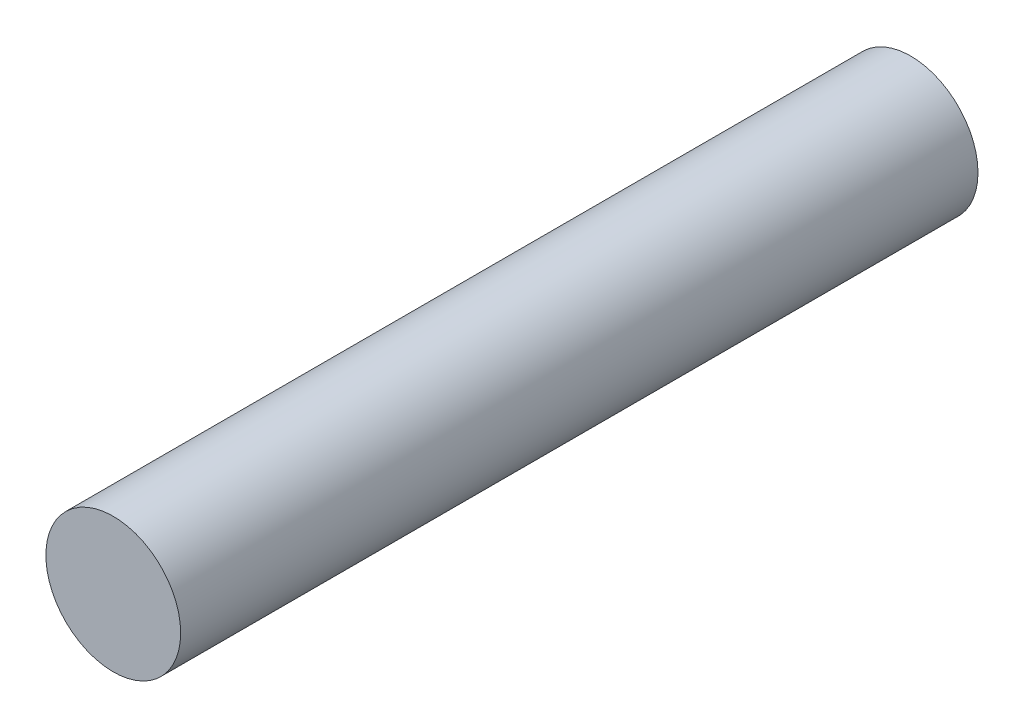
from build123d import *

# Parameters (mm, degrees)
SKETCH2_R           = 2.493640621
BOSS_EXTRUDE1_DEPTH = 29.5


with BuildPart() as part:
    # Sketch2 → Boss-Extrude1 (new body)
    with BuildSketch(Plane.XY):
        with Locations((6.233383853, 6.252122128)):
            Circle(SKETCH2_R)
    extrude(amount=BOSS_EXTRUDE1_DEPTH)


solid = part.part
